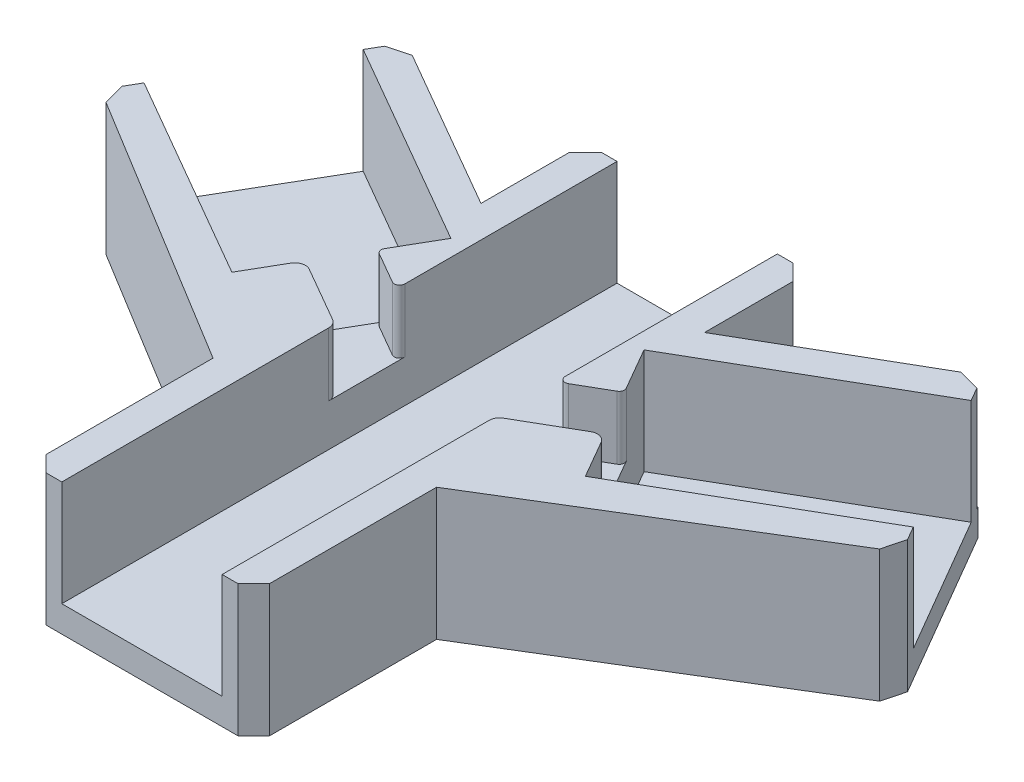
from build123d import *
from OCP.BRepFilletAPI import BRepFilletAPI_MakeChamfer

# Parameters (mm, degrees)
EXTRUDE_1_DEPTH     = 10
EXTRUDE_1_2_DEPTH   = 10
EXTRUDE_1_3_DEPTH   = 10
EXTRUDE_1_4_DEPTH   = 10
EXTRUDE_2_DEPTH     = 2.5
EXTRUDE_3_DEPTH     = 10
CUT_EXTRUDE_1_DEPTH = 6
FILLET_4_R          = 1
FILLET_5_R          = 0.5
CUT_EXTRUDE_2_DEPTH = 50.301485276
CHAMFER_1_SIZE      = 1.5
CHAMFER_1_SIZE2     = 1.532867746
CHAMFER_1_SIZE2_2   = 1.505273584
CHAMFER_2_SIZE      = 1.5
CHAMFER_2_SIZE2     = 4.152297663


with BuildPart() as part:
    # Эскиз1 → Бобышка-Вытянуть1 (new body)
    with BuildSketch(Plane(origin=(0, 0, 0), x_dir=(1, 0, 0), z_dir=(0, 1, 0))):
        Polygon((-7.6, 13.163586138), (-7.6, 28.261662349), (-10.6, 28.261662349), (-10.6, 18.35973856), (-27.750635095, 28.261662349), (-29.250635095, 25.663586138), align=None)
    extrude(amount=EXTRUDE_1_DEPTH)



with BuildPart() as body_2:
    # Эскиз1 → Extrude 1 2 (new body)
    with BuildSketch(Plane(origin=(0, 0, 0), x_dir=(1, 0, 0), z_dir=(0, 1, 0))):
        Polygon((-36.850635095, 12.5), (-7.6, -4.387862046), (-7.6, -24.387862046), (-10.6, -24.387862046), (-10.6, -7.048921698), (-38.414383917, 9.939787192), align=None)
    extrude(amount=EXTRUDE_1_2_DEPTH)


with BuildPart() as body_3:
    # Эскиз1 → Extrude 1 3 (new body)
    with BuildSketch(Plane(origin=(0, 0, 0), x_dir=(1, 0, 0), z_dir=(0, 1, 0))):
        Polygon((7.6, -24.387862046), (7.6, -4.387862046), (36.850635095, 12.5), (38.414383917, 9.939787192), (10.6, -7.048921698), (10.6, -24.387862046), align=None)
    extrude(amount=EXTRUDE_1_3_DEPTH)


with BuildPart() as body_4:
    # Эскиз1 → Extrude 1 4 (new body)
    with BuildSketch(Plane(origin=(0, 0, 0), x_dir=(1, 0, 0), z_dir=(0, 1, 0))):
        Polygon((29.250635095, 25.663586138), (7.6, 13.163586138), (7.6, 28.261662349), (10.6, 28.261662349), (10.6, 18.35973856), (27.750635095, 28.261662349), align=None)
    extrude(amount=EXTRUDE_1_4_DEPTH)


with BuildPart() as part_1:
    add(part.part)

    add(body_2.part)  # Бобышка-Вытянуть2 merges body 2

    add(body_3.part)  # Бобышка-Вытянуть2 merges body 3

    add(body_4.part)  # Бобышка-Вытянуть2 merges body 4
    # Эскиз2 → Бобышка-Вытянуть2 (add)
    with BuildSketch(Plane.XZ):
        Polygon((-10.6, 24.387862046), (10.6, 24.387862046), (10.6, 7.048921698), (38.414383917, -9.939787192), (27.750635095, -28.261662349), (-27.750635095, -28.261662349), (-38.414383917, -9.939787192), (-10.6, 7.048921698), align=None)
    extrude(amount=EXTRUDE_2_DEPTH)

    # Эскиз3 → Бобышка-Вытянуть3 (add)
    with BuildSketch(Plane(origin=(0, 0, 0), x_dir=(1, 0, 0), z_dir=(0, 1, 0))):
        Polygon((9.158845727, 14.063586138), (16.758845727, 0.9), (7.6, -4.387862046), (7.6, 13.163586138), align=None)
        Polygon((-7.6, -4.387862046), (-7.6, 13.163586138), (-9.158845727, 14.063586138), (-16.758845727, 0.9), align=None)
    extrude(amount=EXTRUDE_3_DEPTH)

    # Эскиз4 → Вырез-Вытянуть1 (cut)
    with BuildSketch(Plane(origin=(0, 10, 0), x_dir=(1, 0, 0), z_dir=(0, 1, 0))):
        Polygon((-15.887237696, 6.285749615), (-6.628889419, 0.940439745), (-4.128889419, 5.270566763), (-13.387237696, 10.615876634), align=None)
        Polygon((14.008406819, 10.974508794), (3.507720297, 4.911934604), (6.007720297, 0.581807585), (16.508406819, 6.644381775), align=None)
    extrude(amount=-CUT_EXTRUDE_1_DEPTH, mode=Mode.SUBTRACT)

    # Скругление4
    fillet_4_edges = [part_1.edges().sort_by_distance(p)[0] for p in [
        (-14.208845727, 7, -5.316729559),
        (14.208845727, 7, -5.316729559),
        (-7.6, 7, -1.5011107),
        (7.6, 7, -1.5011107),
    ]]
    fillet(fillet_4_edges, radius=FILLET_4_R)

    # Скругление5
    fillet_5_edges = [part_1.edges().sort_by_distance(p)[0] for p in [
        (-11.708845727, 7, -9.646856578),
        (11.708845727, 7, -9.646856578),
        (-7.6, 7, -7.274613392),
        (7.6, 7, -7.274613392),
    ]]
    fillet(fillet_5_edges, radius=FILLET_5_R)

    # Эскиз5 → Вырез-Вытянуть2 (cut, through all)
    with BuildSketch(Plane(origin=(0, 10, 0), x_dir=(1, 0, 0), z_dir=(0, 1, 0))):
        Polygon((-24.047037107, 33.630998613), (-39.832865352, 6.508644255), (-44.756690746, 10.727475508), (-28.61540602, 34.978771584), align=None)
        Polygon((24.284000657, 33.223860688), (39.70321054, 6.731410124), (44.299549415, 9.406584081), (29.808170892, 34.304885099), align=None)
    extrude(amount=-CUT_EXTRUDE_2_DEPTH, mode=Mode.SUBTRACT)

    # Фаска1: one chamfer whose edges measure the first distance from different faces: ONE call of the kernel's chamfer builder (chamfer() names one face for all edges)
    chamfer_1_edges_1 = [part_1.edges().sort_by_distance(p)[0] for p in [
        (10.6, 5, -28.261662349),
        (-10.6, 3.75, 24.387862046),
        (10.6, 3.75, 24.387862046),
        (-10.6, 5, -28.261662349),
    ]]
    chamfer_1_edges_2 = [part_1.edges().sort_by_distance(p)[0] for p in [
        (-37.987585708, 3.75, -9.679103708),
    ]]
    chamfer_1_side_2 = [part_1.faces().sort_by_distance(p)[0] for p in [
        (-28.072162886, 9.751296174, -26.715245698),
    ]]
    chamfer_1_edges_3 = [part_1.edges().sort_by_distance(p)[0] for p in [
        (-27.317619745, 5, -28.01166082),
    ]]
    chamfer_1_side_3 = [part_1.faces().sort_by_distance(p)[0] for p in [
        (-28.072162886, 9.751296174, -26.715245698),
    ]]
    chamfer_1_edges_4 = [part_1.edges().sort_by_distance(p)[0] for p in [
        (27.317619745, 5, -28.01166082),
    ]]
    chamfer_1_side_4 = [part_1.faces().sort_by_distance(p)[0] for p in [
        (28.072162886, 9.751296174, -26.715245698),
    ]]
    chamfer_1_edges_5 = [part_1.edges().sort_by_distance(p)[0] for p in [
        (37.987585708, 3.75, -9.679103708),
    ]]
    chamfer_1_side_5 = [part_1.faces().sort_by_distance(p)[0] for p in [
        (28.072162886, 9.751296174, -26.715245698),
    ]]
    chamfer_1 = BRepFilletAPI_MakeChamfer(part_1.part.solid().wrapped)
    for e in chamfer_1_edges_1:
        chamfer_1.Add(CHAMFER_1_SIZE, e.wrapped)
    for e in chamfer_1_edges_2:
        chamfer_1.Add(CHAMFER_1_SIZE, CHAMFER_1_SIZE2, e.wrapped, chamfer_1_side_2[0].wrapped)  # the first distance lies on this face
    for e in chamfer_1_edges_3:
        chamfer_1.Add(CHAMFER_1_SIZE, CHAMFER_1_SIZE2_2, e.wrapped, chamfer_1_side_3[0].wrapped)  # the first distance lies on this face
    for e in chamfer_1_edges_4:
        chamfer_1.Add(CHAMFER_1_SIZE, CHAMFER_1_SIZE2_2, e.wrapped, chamfer_1_side_4[0].wrapped)  # the first distance lies on this face
    for e in chamfer_1_edges_5:
        chamfer_1.Add(CHAMFER_1_SIZE, CHAMFER_1_SIZE2, e.wrapped, chamfer_1_side_5[0].wrapped)  # the first distance lies on this face
    add(Compound.cast(chamfer_1.Shape()), mode=Mode.REPLACE)

    # Фаска2: one chamfer whose edges measure the first distance from different faces: ONE call of the kernel's chamfer builder (chamfer() names one face for all edges)
    chamfer_2_edges_1 = [part_1.edges().sort_by_distance(p)[0] for p in [
        (-27.172113158, -1.25, -28.261662349),
    ]]
    chamfer_2_side_1 = [part_1.faces().sort_by_distance(p)[0] for p in [
        (-28.449432149, 9.764143386, -26.067042101),
    ]]
    chamfer_2_edges_2 = [part_1.edges().sort_by_distance(p)[0] for p in [
        (27.172113158, -1.25, -28.261662349),
    ]]
    chamfer_2_side_2 = [part_1.faces().sort_by_distance(p)[0] for p in [
        (28.449432149, 9.764143386, -26.067042101),
    ]]
    chamfer_2 = BRepFilletAPI_MakeChamfer(part_1.part.solid().wrapped)
    for e in chamfer_2_edges_1:
        chamfer_2.Add(CHAMFER_2_SIZE, CHAMFER_2_SIZE2, e.wrapped, chamfer_2_side_1[0].wrapped)  # the first distance lies on this face
    for e in chamfer_2_edges_2:
        chamfer_2.Add(CHAMFER_2_SIZE, CHAMFER_2_SIZE2, e.wrapped, chamfer_2_side_2[0].wrapped)  # the first distance lies on this face
    add(Compound.cast(chamfer_2.Shape()), mode=Mode.REPLACE)


solid = part_1.part
